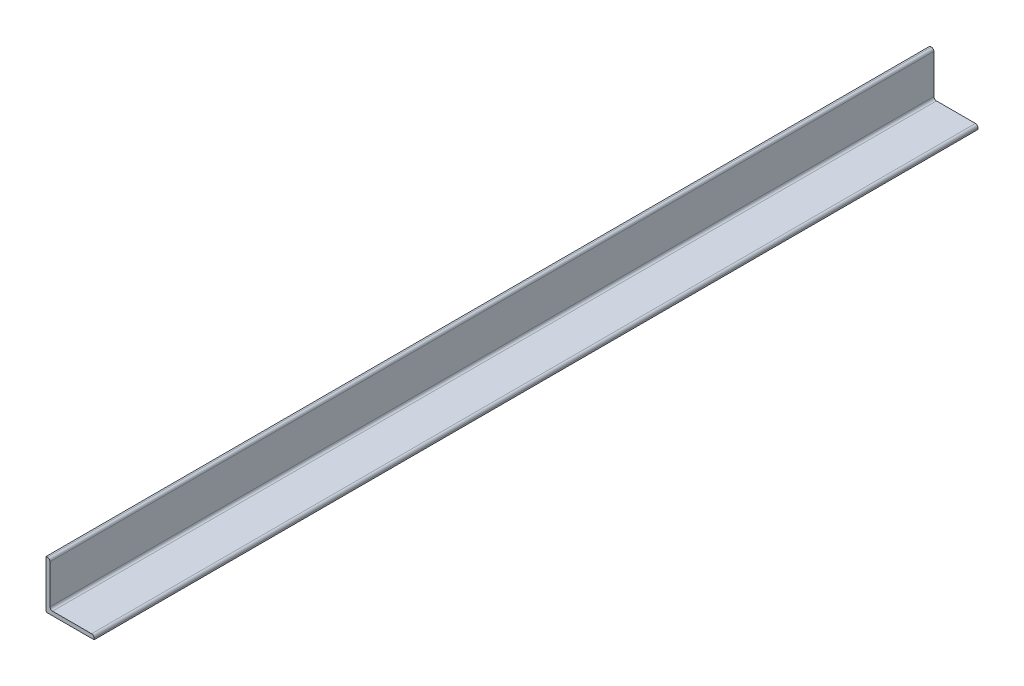
from build123d import *

# Parameters (mm, degrees)
BOSS_EXTRUDE1_DEPTH = 350
FILLET1_R           = 1
FILLET2_R           = 0.5


with BuildPart() as part:
    # Sketch1 → Boss-Extrude1 (new body)
    with BuildSketch(Plane.XY):
        Polygon((0, 0), (0, 19.05), (1.5875, 19.05), (1.5875, 1.5875), (19.05, 1.5875), (19.05, 0), align=None)
    extrude(amount=BOSS_EXTRUDE1_DEPTH)

    # Fillet1
    fillet1_edges = [part.edges().sort_by_distance(p)[0] for p in [
        (1.5875, 19.05, 175),
        (1.5875, 1.5875, 175),
        (19.05, 1.5875, 175),
    ]]
    fillet(fillet1_edges, radius=FILLET1_R)

    # Fillet2
    fillet2_edges = [part.edges().sort_by_distance(p)[0] for p in [
        (0, 0, 175),
    ]]
    fillet(fillet2_edges, radius=FILLET2_R)


solid = part.part
